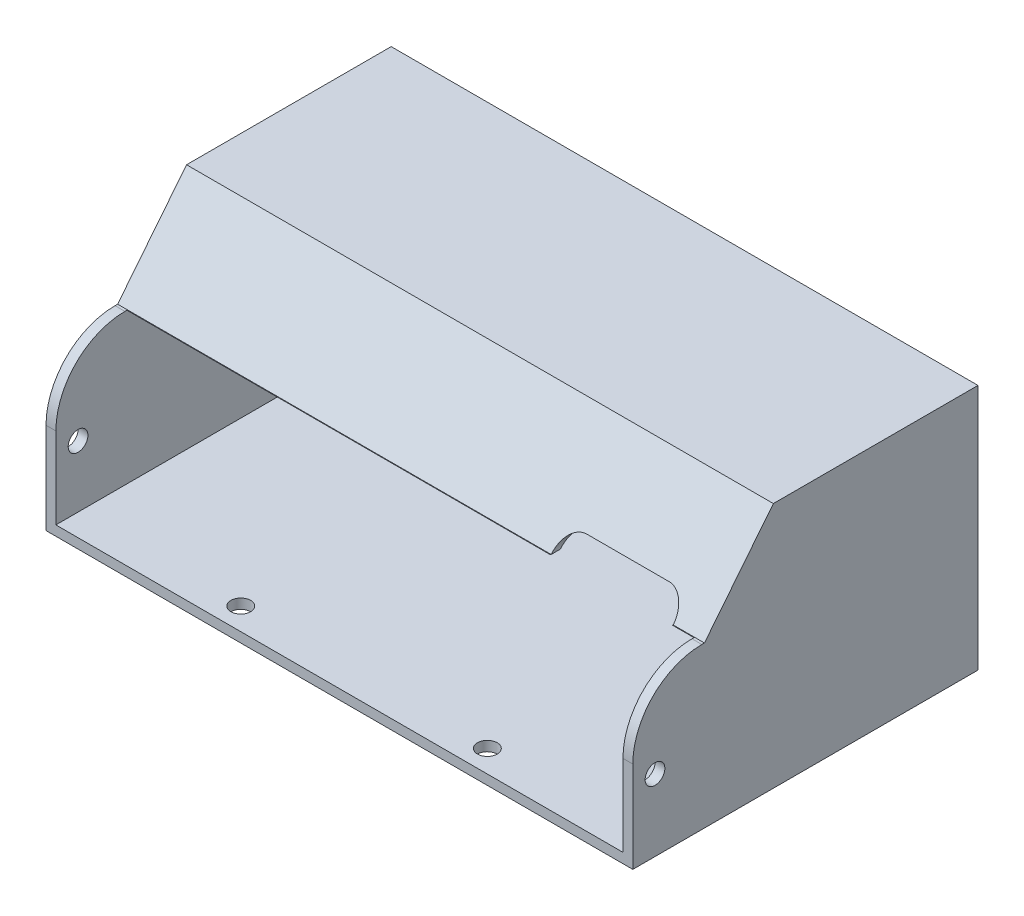
from build123d import *

# Parameters (mm, degrees)
SKETCH1_W               = 119
SKETCH1_H               = 50
BOSS_EXTRUDE1_DEPTH     = 70
SKETCH2_W               = 115
SKETCH2_H               = 46
CUT_EXTRUDE1_DEPTH      = 67
SKETCH3_W               = 50
SKETCH3_H               = 29
CUT_EXTRUDE2_DEPTH      = 10
SKETCH4_R               = 1.95
CUT_EXTRUDE3_DEPTH      = 10
SKETCH5_R               = 3.25
SKETCH5_R_2             = 1.95
BOSS_EXTRUDE3_DEPTH     = 10
FILLET1_R               = 2
SKETCH6_R               = 2
CUT_EXTRUDE4_DEPTH      = 10
CUT_EXTRUDE5_DEPTH      = 146.220522014
CUT_EXTRUDE5_DEPTH_BACK = 146.220522014
SKETCH8_R               = 2
BOSS_EXTRUDE4_DEPTH     = 115
CUT_EXTRUDE6_DEPTH      = 146.220522014
CUT_EXTRUDE6_DEPTH_BACK = 146.220522014
FILLET2_R               = 14
CUT_EXTRUDE8_DEPTH      = 10
CUT_EXTRUDE9_DEPTH      = 143.341139563


with BuildPart() as part:
    # Sketch1 → Boss-Extrude1 (new body)
    with BuildSketch(Plane.XY):
        with Locations((59.5, 25)):
            Rectangle(SKETCH1_W, SKETCH1_H)
    extrude(amount=BOSS_EXTRUDE1_DEPTH)

    # Sketch2 → Cut-Extrude1 (cut)
    with BuildSketch(Plane.XY.offset(70)):
        with Locations((59.5, 25)):
            Rectangle(SKETCH2_W, SKETCH2_H)
    extrude(amount=-CUT_EXTRUDE1_DEPTH, mode=Mode.SUBTRACT)

    # Sketch3 → Cut-Extrude2 (cut)
    with BuildSketch(Plane.XY.offset(3)):
        with Locations((33, 25)):
            Rectangle(SKETCH3_W, SKETCH3_H)
    extrude(amount=-CUT_EXTRUDE2_DEPTH, mode=Mode.SUBTRACT)

    # Sketch4 → Cut-Extrude3 (cut)
    with BuildSketch(Plane(origin=(0, 0, 0), x_dir=(-1, 0, 0), z_dir=(0, 0, -1))):
        with Locations((-32.95, 45)):
            Circle(SKETCH4_R)
        with Locations((-32.95, 5)):
            Circle(SKETCH4_R)
    extrude(amount=-CUT_EXTRUDE3_DEPTH, mode=Mode.SUBTRACT)

    # Sketch5 → Boss-Extrude3 (add)
    # profile 1 of 2: a face of its own
    with BuildSketch(Plane.XY.offset(3)):
        with Locations((32.95, 45)):
            Circle(SKETCH5_R)
        with Locations(Location((32.95, 45, 0), (0, 0, 180))):
            Circle(SKETCH5_R_2, mode=Mode.SUBTRACT)
    # profile 2 of 2: a face of its own
    with BuildSketch(Plane.XY.offset(3)):
        with Locations((32.95, 5)):
            Circle(SKETCH5_R)
        with Locations(Location((32.95, 5, 0), (0, 0, 180))):
            Circle(SKETCH5_R_2, mode=Mode.SUBTRACT)
    extrude(amount=BOSS_EXTRUDE3_DEPTH)

    # Fillet1
    fillet1_edges = [part.edges().sort_by_distance(p)[0] for p in [
        (31.147224362, 42.295836543, 3),
        (31.147224362, 7.704163457, 3),
    ]]
    fillet(fillet1_edges, radius=FILLET1_R)

    # Sketch6 → Cut-Extrude4 (cut)
    with BuildSketch(Plane(origin=(0, 2, 0), x_dir=(1, 0, 0), z_dir=(0, 1, 0))):
        with Locations(Location((85, -65.5, 0), (0, 0, 180))):
            Circle(SKETCH6_R)
        with Locations(Location((35, -65.5, 0), (0, 0, 180))):
            Circle(SKETCH6_R)
    extrude(amount=-CUT_EXTRUDE4_DEPTH, mode=Mode.SUBTRACT)

    # Sketch8 → Cut-Extrude5 (cut, two sides: drawn at the far end of the back side and taken through both)
    with BuildSketch(Plane(origin=(2, 0, 0), x_dir=(0, 0, -1), z_dir=(1, 0, 0)).offset(-CUT_EXTRUDE5_DEPTH_BACK)):
        with Locations(Location((-65.5, 14.5, 0), (0, 0, 90))):
            Circle(SKETCH8_R)
    extrude(amount=CUT_EXTRUDE5_DEPTH + CUT_EXTRUDE5_DEPTH_BACK, mode=Mode.SUBTRACT)

    # Sketch9 → Boss-Extrude4 (add)
    with BuildSketch(Plane(origin=(2, 0, 0), x_dir=(0, 0, -1), z_dir=(1, 0, 0))):
        Polygon((-55.594060536, 32.500624229), (-43.169621176, 48), (-41.169621176, 48), (-53.594060926, 32.499375771), align=None)
    extrude(amount=BOSS_EXTRUDE4_DEPTH)

    # Sketch10 → Cut-Extrude6 (cut, two sides: drawn at the far end of the back side and taken through both)
    with BuildSketch(Plane(origin=(2, 0, 0), x_dir=(0, 0, -1), z_dir=(1, 0, 0)).offset(-CUT_EXTRUDE6_DEPTH_BACK)):
        Polygon((-55.471753528, 32.500624229), (-70, 32.500624229), (-70, 50), (-41.5, 50), align=None)
    extrude(amount=CUT_EXTRUDE6_DEPTH + CUT_EXTRUDE6_DEPTH_BACK, mode=Mode.SUBTRACT)

    # Fillet2
    fillet2_edges = [part.edges().sort_by_distance(p)[0] for p in [
        (118, 32.500624229, 70),
        (1, 32.500624229, 70),
    ]]
    fillet(fillet2_edges, radius=FILLET2_R)

    # Sketch11 → Cut-Extrude8 (cut)
    with BuildSketch(Plane(origin=(0, 0, 0), x_dir=(-1, 0, 0), z_dir=(0, 0, -1))):
        with BuildLine():
            Line((-109.202811856, 45), (-109.202811856, 5))
            ThreePointArc((-109.202811856, 5), (-111, 3.202811856), (-112.797188144, 5))
            Line((-112.797188144, 5), (-112.797188144, 45))
            ThreePointArc((-112.797188144, 45), (-111, 46.797188144), (-109.202811856, 45))
        make_face()
        with BuildLine():
            Line((-102.202811856, 45), (-102.202811856, 5))
            ThreePointArc((-102.202811856, 5), (-104, 3.202811856), (-105.797188144, 5))
            Line((-105.797188144, 5), (-105.797188144, 45))
            ThreePointArc((-105.797188144, 45), (-104, 46.797188144), (-102.202811856, 45))
        make_face()
        with BuildLine():
            Line((-95.202811856, 45), (-95.202811856, 5))
            ThreePointArc((-95.202811856, 5), (-97, 3.202811856), (-98.797188144, 5))
            Line((-98.797188144, 5), (-98.797188144, 45))
            ThreePointArc((-98.797188144, 45), (-97, 46.797188144), (-95.202811856, 45))
        make_face()
        with BuildLine():
            Line((-88.202811856, 45), (-88.202811856, 5))
            ThreePointArc((-88.202811856, 5), (-90, 3.202811856), (-91.797188144, 5))
            Line((-91.797188144, 5), (-91.797188144, 45))
            ThreePointArc((-91.797188144, 45), (-90, 46.797188144), (-88.202811856, 45))
        make_face()
        with BuildLine():
            Line((-81.202811856, 45), (-81.202811856, 5))
            ThreePointArc((-81.202811856, 5), (-83, 3.202811856), (-84.797188144, 5))
            Line((-84.797188144, 5), (-84.797188144, 45))
            ThreePointArc((-84.797188144, 45), (-83, 46.797188144), (-81.202811856, 45))
        make_face()
        with BuildLine():
            Line((-74.202811856, 45), (-74.202811856, 5))
            ThreePointArc((-74.202811856, 5), (-76, 3.202811856), (-77.797188144, 5))
            Line((-77.797188144, 5), (-77.797188144, 45))
            ThreePointArc((-77.797188144, 45), (-76, 46.797188144), (-74.202811856, 45))
        make_face()
        with BuildLine():
            Line((-67.202811856, 45), (-67.202811856, 5))
            ThreePointArc((-67.202811856, 5), (-69, 3.202811856), (-70.797188144, 5))
            Line((-70.797188144, 5), (-70.797188144, 45))
            ThreePointArc((-70.797188144, 45), (-69, 46.797188144), (-67.202811856, 45))
        make_face()
    extrude(amount=-CUT_EXTRUDE8_DEPTH, mode=Mode.SUBTRACT)

    # Sketch12 → Cut-Extrude9 (cut, through all)
    with BuildSketch(Plane.XY.offset(10)):
        with BuildLine():
            Line((108.667383108, 28.499375771), (91.910743178, 28.499375771))
            ThreePointArc((91.910743178, 28.499375771), (87.910743178, 32.499375771), (91.910743178, 36.499375771))
            Line((91.910743178, 36.499375771), (108.667383108, 36.499375771))
            ThreePointArc((108.667383108, 36.499375771), (112.667383108, 32.499375771), (108.667383108, 28.499375771))
        make_face()
    extrude(amount=CUT_EXTRUDE9_DEPTH, mode=Mode.SUBTRACT)


solid = part.part
